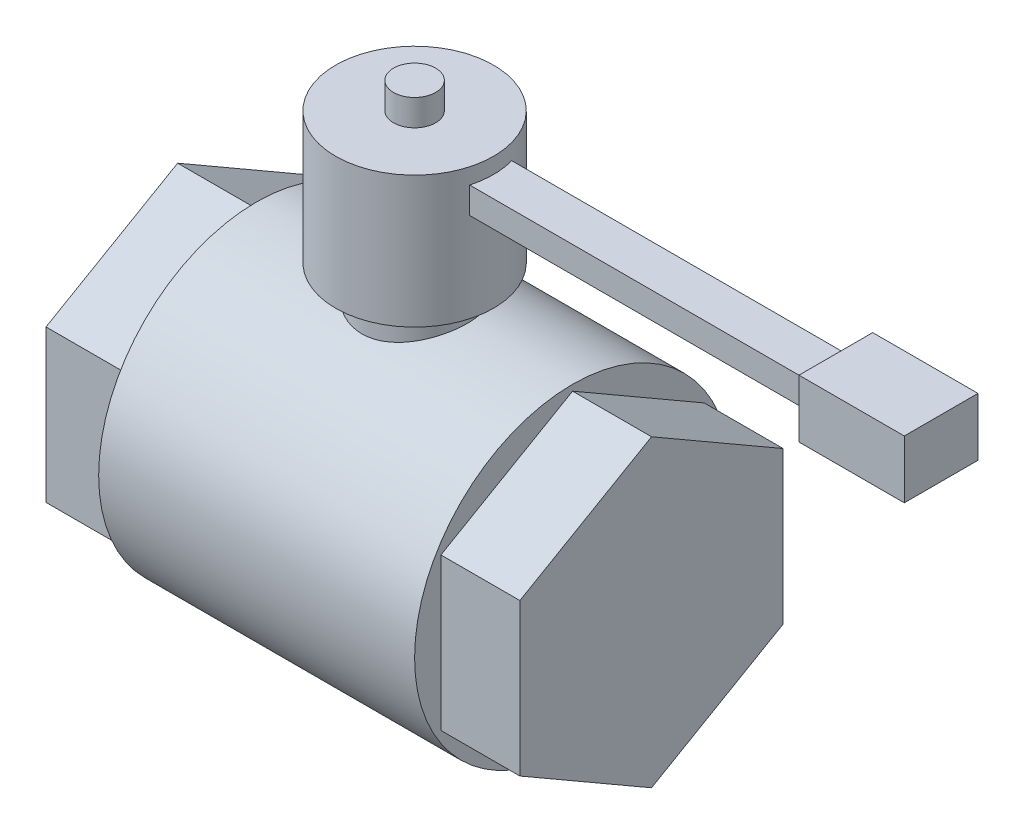
from build123d import *

# Parameters (mm, degrees)
EXTRUDE_334_DEPTH = 15
SKETCH_2_R        = 30
EXTRUDE_1_DEPTH   = 60
EXTRUDE_2_DEPTH   = 15
SKETCH_4_R        = 10
EXTRUDE_3_DEPTH   = 35
SKETCH_5_R        = 15
EXTRUDE_4_DEPTH   = 25
SKETCH_6_R        = 4
EXTRUDE_5_DEPTH   = 5
EXTRUDE_6_DEPTH   = 100
SKETCH_8_W        = 14
SKETCH_8_H        = 11
EXTRUDE_7_DEPTH   = 20


with BuildPart() as part:
    # Эскиз1 → Extrude 334 (new body)
    with BuildSketch(Plane(origin=(0, 0, 0), x_dir=(0, 0, -1), z_dir=(1, 0, 0))):
        Polygon((0, 28.867513459), (-25, 14.43375673), (-25, -14.43375673), (0, -28.867513459), (25, -14.43375673), (25, 14.43375673), align=None)
    extrude(amount=EXTRUDE_334_DEPTH)

    # Эскиз2 → Бобышка-Вытянуть1 (add)
    with BuildSketch(Plane.ZY):
        Circle(SKETCH_2_R)
    extrude(amount=EXTRUDE_1_DEPTH)

    # Эскиз3 → Бобышка-Вытянуть2 (add)
    with BuildSketch(Plane.ZY.offset(60)):
        Polygon((0, 28.867513459), (-25, 14.43375673), (-25, -14.43375673), (0, -28.867513459), (25, -14.43375673), (25, 14.43375673), align=None)
    extrude(amount=EXTRUDE_2_DEPTH)

    # Эскиз4 → Бобышка-Вытянуть3 (add)
    with BuildSketch(Plane(origin=(0, 0, 0), x_dir=(1, 0, 0), z_dir=(0, 1, 0))):
        with Locations((-30, 0)):
            Circle(SKETCH_4_R)
    extrude(amount=EXTRUDE_3_DEPTH)

    # Эскиз5 → Бобышка-Вытянуть4 (add)
    with BuildSketch(Plane(origin=(0, 35, 0), x_dir=(-1, 0, 0), z_dir=(0, 1, 0))):
        with Locations((30, 0)):
            Circle(SKETCH_5_R)
    extrude(amount=EXTRUDE_4_DEPTH)

    # Эскиз6 → Бобышка-Вытянуть5 (add)
    with BuildSketch(Plane(origin=(0, 60, 0), x_dir=(-1, 0, 0), z_dir=(0, 1, 0))):
        with Locations((30, 0)):
            Circle(SKETCH_6_R)
    extrude(amount=EXTRUDE_5_DEPTH)

    # Эскиз7 → Бобышка-Вытянуть6 (add)
    with BuildSketch(Plane(origin=(-30, 0, 0), x_dir=(0, 0, -1), z_dir=(1, 0, 0))):
        Polygon((-4, 57), (0, 57), (4, 57), (4, 52), (-4, 52), align=None)
    extrude(amount=EXTRUDE_6_DEPTH)

    # Эскиз8 → Бобышка-Вытянуть7 (add)
    with BuildSketch(Plane(origin=(70, 0, 0), x_dir=(0, 0, -1), z_dir=(1, 0, 0))):
        with Locations((0, 54.5)):
            Rectangle(SKETCH_8_W, SKETCH_8_H)
    extrude(amount=-EXTRUDE_7_DEPTH)


solid = part.part
